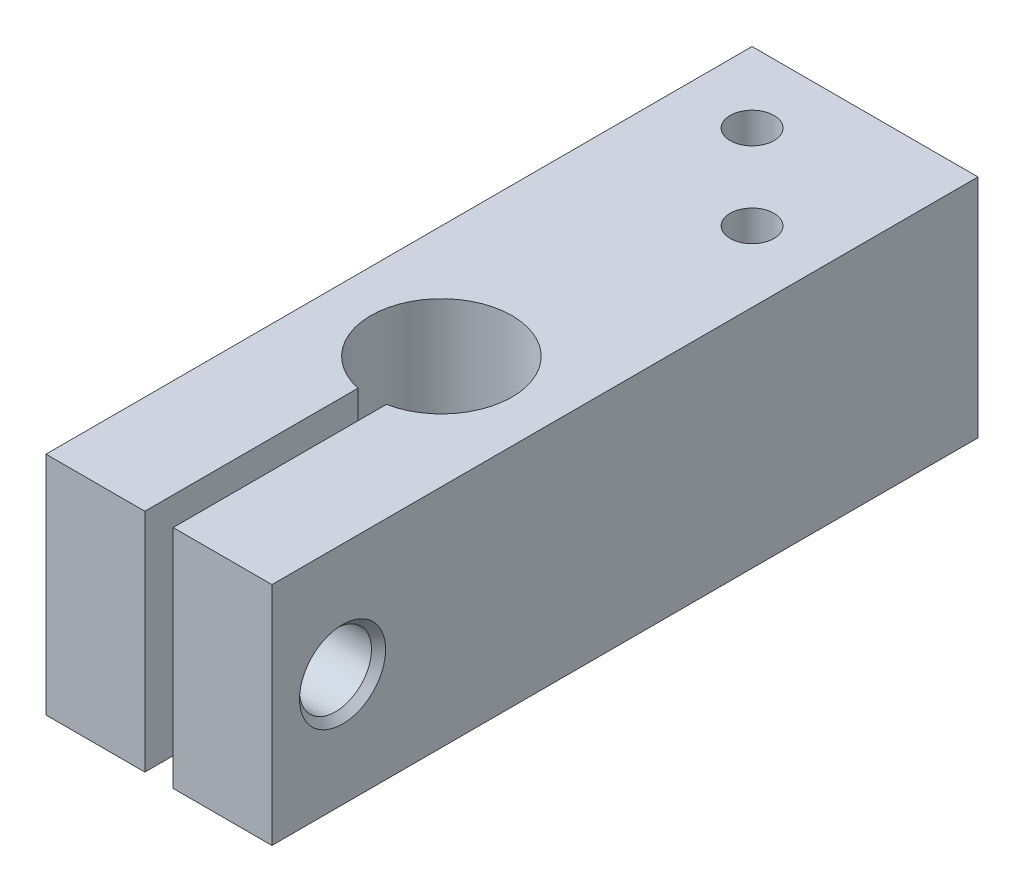
from build123d import *

# Parameters (mm, degrees)
SKETCH1_W                              = 16
SKETCH1_H                              = 16
BASE_DEPTH                             = 50
SKETCH2_R                              = 5
RODSLOT_DEPTH                          = 54.103672189
RODSLOTSCREW_REACH                     = 55.104
SKETCH3_R                              = 2.55
CHAMFER1_SIZE                          = 0.5
M5X0_8_TAPPED_HOLE_FOR_ROD_SCREW_D     = 4.2
M5X0_8_TAPPED_HOLE_FOR_ROD_SCREW_DEPTH = 7.6381927
M5X0_8_TAPPED_HOLE_FOR_ROD_SCREW_TIP   = 1.2618073
SKETCH6_R                              = 1.55
SCREWSHOLES_DEPTH                      = 54.103672189


with BuildPart() as part:
    # Sketch1 → Base (new body)
    with BuildSketch(Plane.XY):
        Rectangle(SKETCH1_W, SKETCH1_H)
    extrude(amount=BASE_DEPTH)

    # Sketch2 → RodSlot (cut, through all)
    with BuildSketch(Plane(origin=(0, 8, 0), x_dir=(1, 0, 0), z_dir=(0, 1, 0))):
        with Locations((0, -30)):
            Circle(SKETCH2_R)
        with BuildLine():
            Line((-1, -34.898979486), (-1, -50))
            Line((-1, -50), (1, -50))
            Line((1, -50), (1, -34.898979486))
            ThreePointArc((1, -34.898979486), (0, -35), (-1, -34.898979486))
        make_face()
    extrude(amount=-RODSLOT_DEPTH, mode=Mode.SUBTRACT)

    # Sketch3 → RodSlotScrew (cut, up to next)
    with BuildSketch(Plane(origin=(8, 0, 0), x_dir=(0, 0, -1), z_dir=(1, 0, 0)), mode=Mode.PRIVATE) as rodslotscrew_sk1:
        with Locations((-45, 0)):
            Circle(SKETCH3_R)
    rodslotscrew_tool1 = extrude(rodslotscrew_sk1.sketch, amount=-RODSLOTSCREW_REACH, mode=Mode.PRIVATE) & part.part
    add(rodslotscrew_tool1.solids().sort_by_distance((8, 0, 45))[0], mode=Mode.SUBTRACT)

    # Chamfer1
    chamfer1_edges = [part.edges().sort_by_distance(p)[0] for p in [
        (8, 0, 47.55),
    ]]
    chamfer(chamfer1_edges, length=CHAMFER1_SIZE)

    # M5x0.8 Tapped Hole for rod screw
    with Locations(Plane.ZY.offset(8)):
        with Locations((45, 0)):
            Hole(M5X0_8_TAPPED_HOLE_FOR_ROD_SCREW_D / 2, depth=M5X0_8_TAPPED_HOLE_FOR_ROD_SCREW_DEPTH)
            with Locations((0, 0, -(M5X0_8_TAPPED_HOLE_FOR_ROD_SCREW_DEPTH + M5X0_8_TAPPED_HOLE_FOR_ROD_SCREW_TIP / 2))):  # 118° drill point
                Cone(0, M5X0_8_TAPPED_HOLE_FOR_ROD_SCREW_D / 2, M5X0_8_TAPPED_HOLE_FOR_ROD_SCREW_TIP, mode=Mode.SUBTRACT)

    # Sketch6 → ScrewsHoles (cut, through all)
    with BuildSketch(Plane.XZ.offset(8)):
        with Locations((3, 11)):
            Circle(SKETCH6_R)
        with Locations((-3, 5)):
            Circle(SKETCH6_R)
    extrude(amount=-SCREWSHOLES_DEPTH, mode=Mode.SUBTRACT)


solid = part.part
